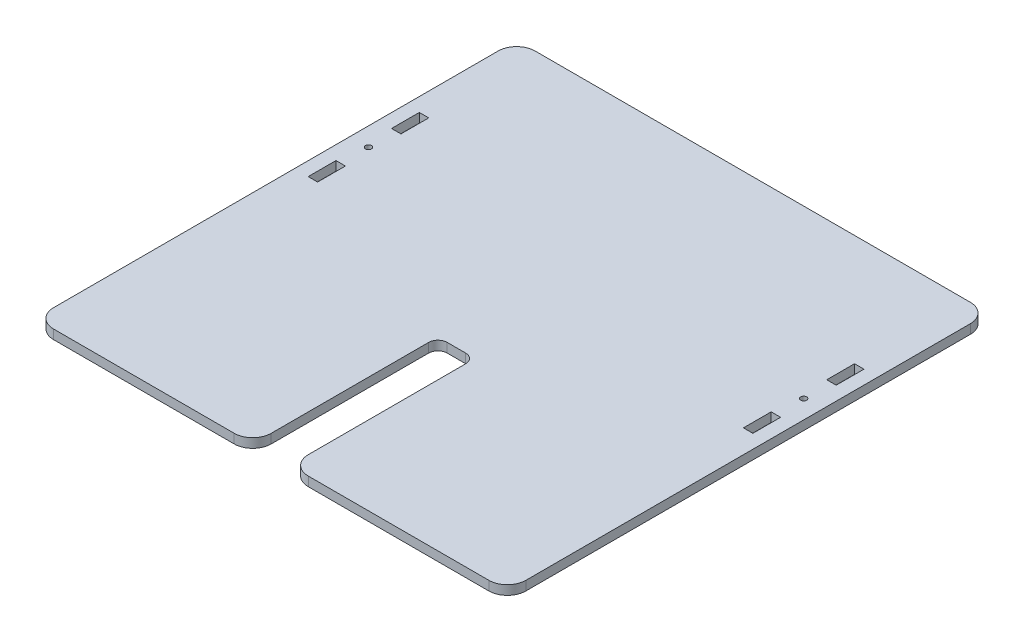
from build123d import *

# Parameters (mm, degrees)
SKETCH1_R           = 1.6
SKETCH1_W           = 5.099999999
SKETCH1_H           = 15
SKETCH1_W_2         = 5.099999998
SKETCH1_W_3         = 5.1
BOSS_EXTRUDE1_DEPTH = 5


with BuildPart() as part:
    # Sketch1 → Boss-Extrude1 (new body)
    with BuildSketch(Plane(origin=(0, 0, 0), x_dir=(1, 0, 0), z_dir=(0, 1, 0))):
        with BuildLine():
            Line((-42.697719413, 225.280869355), (192.302280587, 225.280869355))
            ThreePointArc((192.302280587, 225.280869355), (199.373348399, 222.351937167), (202.302280587, 215.280869355))
            Line((202.302280587, 215.280869355), (202.302280587, -24.719130645))
            ThreePointArc((202.302280587, -24.719130645), (199.373348399, -31.790198457), (192.302280587, -34.719130645))
            Line((192.302280587, -34.719130645), (94.802280587, -34.719130645))
            ThreePointArc((94.802280587, -34.719130645), (87.731212775, -31.790198457), (84.802280587, -24.719130645))
            Line((84.802280587, -24.719130645), (84.802280587, 60.280869355))
            ThreePointArc((84.802280587, 60.280869355), (83.337814493, 63.816403261), (79.802280587, 65.280869355))
            Line((79.802280587, 65.280869355), (69.802280587, 65.280869355))
            ThreePointArc((69.802280587, 65.280869355), (66.266746681, 63.816403261), (64.802280587, 60.280869355))
            Line((64.802280587, 60.280869355), (64.802280587, -24.719130645))
            ThreePointArc((64.802280587, -24.719130645), (61.873348399, -31.790198457), (54.802280587, -34.719130645))
            Line((54.802280587, -34.719130645), (-42.697719413, -34.719130645))
            ThreePointArc((-42.697719413, -34.719130645), (-49.768787225, -31.790198457), (-52.697719413, -24.719130645))
            Line((-52.697719413, -24.719130645), (-52.697719413, 215.280869355))
            ThreePointArc((-52.697719413, 215.280869355), (-49.768787225, 222.351937167), (-42.697719413, 225.280869355))
        make_face()
        with Locations(Location((192.302280587, 135.280869355, 0), (0, 0, 270))):
            Circle(SKETCH1_R, mode=Mode.SUBTRACT)
        with Locations(Location((-42.697719413, 135.280869355, 0), (0, 0, 270))):
            Circle(SKETCH1_R, mode=Mode.SUBTRACT)
        with Locations((192.302280588, 157.780869355)):
            Rectangle(SKETCH1_W, SKETCH1_H, mode=Mode.SUBTRACT)
        with Locations((192.302280587, 112.780869355)):
            Rectangle(SKETCH1_W_2, SKETCH1_H, mode=Mode.SUBTRACT)
        with Locations((-42.697719413, 157.780869355)):
            Rectangle(SKETCH1_W_3, SKETCH1_H, mode=Mode.SUBTRACT)
        with Locations((-42.697719413, 112.780869355)):
            Rectangle(SKETCH1_W_3, SKETCH1_H, mode=Mode.SUBTRACT)
    extrude(amount=BOSS_EXTRUDE1_DEPTH)


solid = part.part
